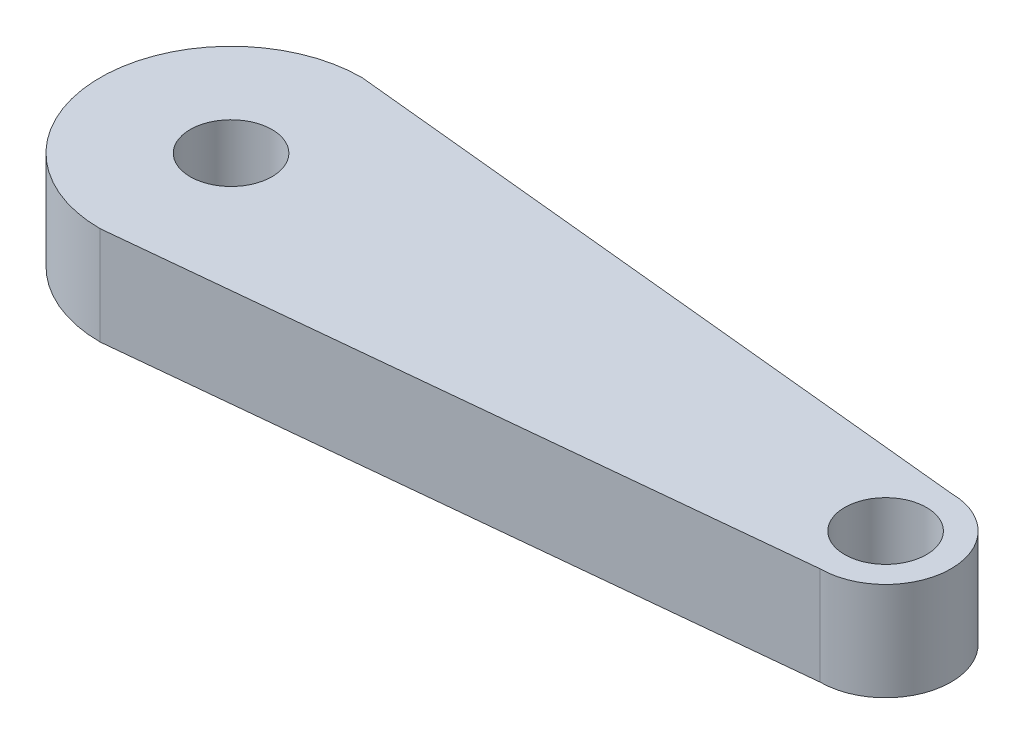
from build123d import *

# Parameters (mm, degrees)
BOSS_EXTRUDE1_DEPTH = 60
SKETCH3_R           = 25
CUT_EXTRUDE1_DEPTH  = 50


with BuildPart() as part:
    # Sketch2 → Boss-Extrude1 (new body)
    with BuildSketch(Plane(origin=(0, 0, 0), x_dir=(1, 0, 0), z_dir=(0, 1, 0))):
        with BuildLine():
            Line((0, 80), (400, 40))
            ThreePointArc((400, 40), (440, 0), (400, -40))
            Line((400, -40), (0, -80))
            ThreePointArc((0, -80), (-80, 0), (0, 80))
        make_face()
    extrude(amount=BOSS_EXTRUDE1_DEPTH)

    # Sketch3 → Cut-Extrude1 (cut)
    with BuildSketch(Plane(origin=(0, 60, 0), x_dir=(1, 0, 0), z_dir=(0, 1, 0))):
        with Locations(Location((0, 0, 0), (0, 0, 270))):
            Circle(SKETCH3_R)
        with Locations(Location((400, 0, 0), (0, 0, 270))):
            Circle(SKETCH3_R)
    extrude(amount=-CUT_EXTRUDE1_DEPTH, mode=Mode.SUBTRACT)


solid = part.part
